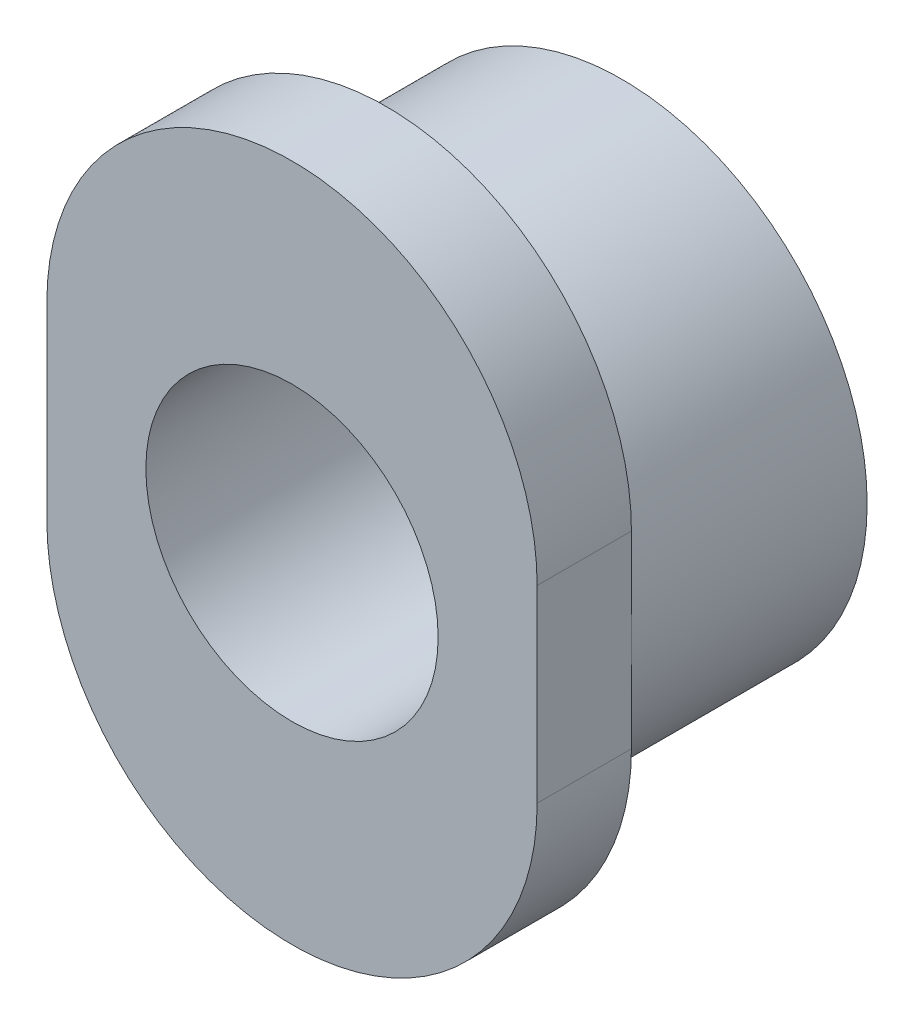
from build123d import *

# Parameters (mm, degrees)
SZKIC1_R                    = 2.6
SZKIC1_R_2                  = 1.55
DODANIE_WYCI_GNI_CIE1_DEPTH = 2.5
SZKIC2_R                    = 1.55
DODANIE_WYCI_GNI_CIE2_DEPTH = 1


with BuildPart() as part:
    # Szkic1 → Dodanie-wyciągnięcie1 (new body)
    with BuildSketch(Plane.XY):
        Circle(SZKIC1_R)
        Circle(SZKIC1_R_2, mode=Mode.SUBTRACT)
    extrude(amount=DODANIE_WYCI_GNI_CIE1_DEPTH)

    # Szkic2 → Dodanie-wyciągnięcie2 (add)
    with BuildSketch(Plane.XY.offset(2.5)):
        with BuildLine():
            Line((-2.6, -1), (-2.6, 1))
            ThreePointArc((-2.6, 1), (0, 3.6), (2.6, 1))
            Line((2.6, 1), (2.6, -1))
            ThreePointArc((2.6, -1), (0, -3.6), (-2.6, -1))
        make_face()
        Circle(SZKIC2_R, mode=Mode.SUBTRACT)
    extrude(amount=DODANIE_WYCI_GNI_CIE2_DEPTH)


solid = part.part
